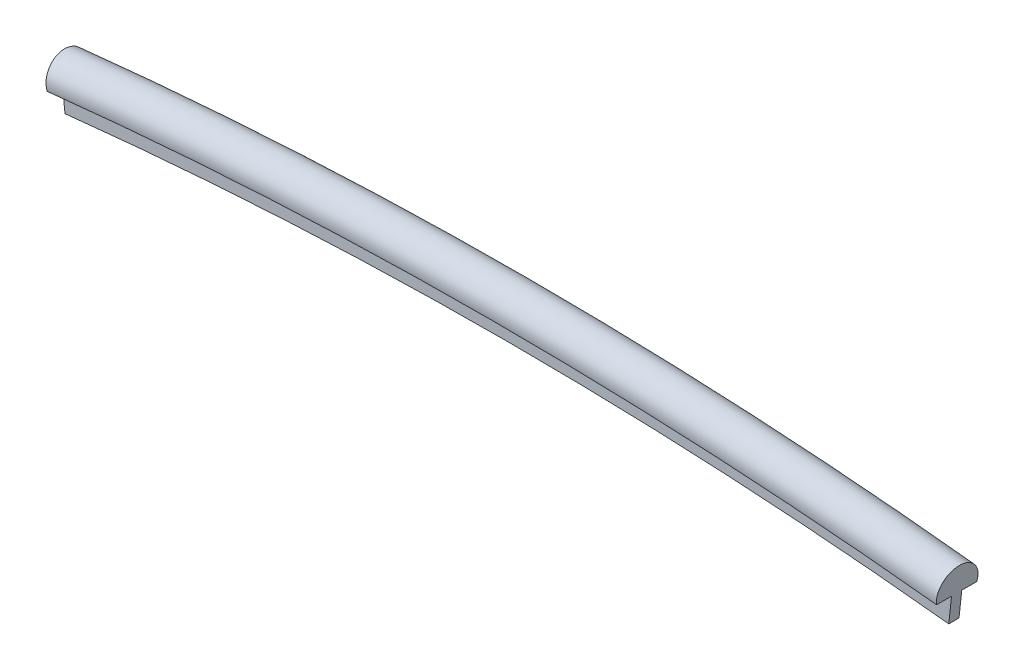
from build123d import *

# Parameters (mm, degrees)
REVOLVE1_ANGLE           = 6.202101222
REVOLVE1_OTHER_WAY_ANGLE = 6.202101222


with BuildPart() as part:
    # Sketch2 → Revolve1 (revolve)
    with BuildSketch(Plane(origin=(0, 0, 0), x_dir=(0, 0, -1), z_dir=(1, 0, 0))):
        with BuildLine():
            Line((0, 239.8), (0.3, 239.8))
            Line((0.3, 239.8), (0.3, 241.3))
            Line((0.3, 241.3), (1.18, 241.3))
            ThreePointArc((1.18, 241.3), (0, 242.800182019), (-1.18, 241.3))
            Line((-1.18, 241.3), (-0.3, 241.3))
            Line((-0.3, 241.3), (-0.3, 239.8))
            Line((-0.3, 239.8), (0, 239.8))
        make_face()
    revolve(axis=Axis((0, 0, 70.597641597), (0, 0, -1)), revolution_arc=REVOLVE1_ANGLE)

    # Sketch2 → Revolve1 other way (revolve)
    with BuildSketch(Plane(origin=(0, 0, 0), x_dir=(0, 0, -1), z_dir=(1, 0, 0))):
        with BuildLine():
            Line((0, 239.8), (0.3, 239.8))
            Line((0.3, 239.8), (0.3, 241.3))
            Line((0.3, 241.3), (1.18, 241.3))
            ThreePointArc((1.18, 241.3), (0, 242.800182019), (-1.18, 241.3))
            Line((-1.18, 241.3), (-0.3, 241.3))
            Line((-0.3, 241.3), (-0.3, 239.8))
            Line((-0.3, 239.8), (0, 239.8))
        make_face()
    revolve(axis=Axis((0, 0, 70.597641597), (0, 0, 1)), revolution_arc=REVOLVE1_OTHER_WAY_ANGLE)


solid = part.part
